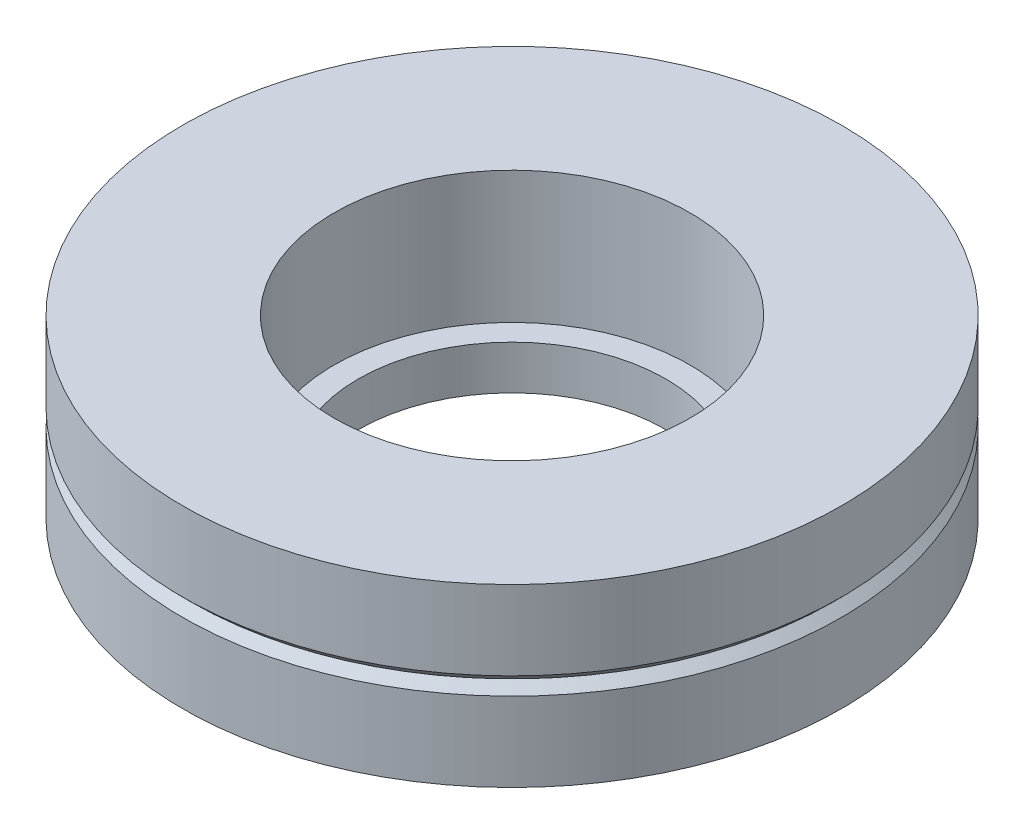
from build123d import *

# Parameters (mm, degrees)
SKETCH2_R          = 8.1
CUT_EXTRUDE1_DEPTH = 6
SKETCH3_R          = 7
CUT_EXTRUDE2_DEPTH = 6


with BuildPart() as part:
    # Sketch1 → Revolve1 (revolve)
    with BuildSketch(Plane.XY, mode=Mode.PRIVATE) as revolve1_sk:
        Polygon((2.5, 8), (15, 8), (15, 4.4), (14.6, 4), (15, 3.6), (15, 0), (2.5, 0), align=None)
    revolve(revolve1_sk.sketch.rotate(Axis((0, 0, 0), (0, 1, 0)), 90), axis=Axis((0, 0, 0), (0, 1, 0)))

    # Sketch2 → Cut-Extrude1 (cut)
    with BuildSketch(Plane(origin=(0, 8, 0), x_dir=(1, 0, 0), z_dir=(0, 1, 0))):
        with Locations(Location((0, 0, 0), (0, 0, 270))):
            Circle(SKETCH2_R)
    extrude(amount=-CUT_EXTRUDE1_DEPTH, mode=Mode.SUBTRACT)

    # Sketch3 → Cut-Extrude2 (cut)
    with BuildSketch(Plane(origin=(0, 2, 0), x_dir=(1, 0, 0), z_dir=(0, 1, 0))):
        with Locations(Location((0, 0, 0), (0, 0, 270))):
            Circle(SKETCH3_R)
    extrude(amount=-CUT_EXTRUDE2_DEPTH, mode=Mode.SUBTRACT)


solid = part.part
